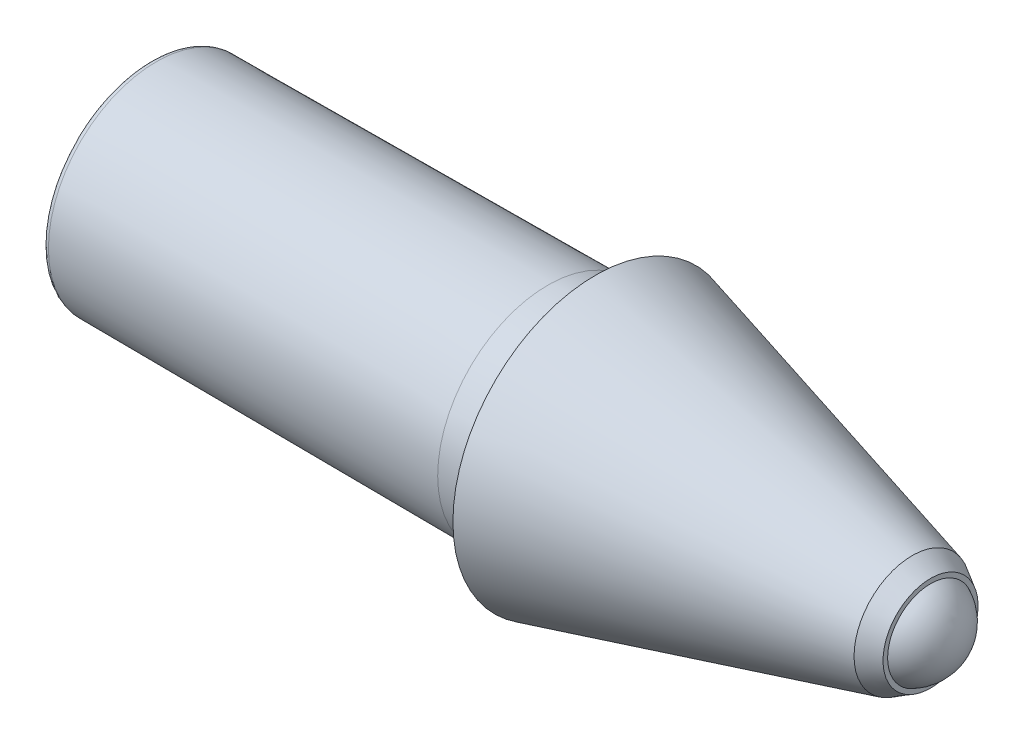
from build123d import *


with BuildPart() as part:
    # Sketch1 → Base-Revolve (revolve)
    with BuildSketch(Plane.XY, mode=Mode.PRIVATE) as base_revolve_sk:
        with BuildLine():
            Line((0, 0.465), (0, 0.860275583))
            ThreePointArc((0, 0.860275583), (0.014547094, 0.895533085), (0.049723658, 0.910274819))
            Line((0.049723658, 0.910274819), (3.35, 0.928515223))
            Line((3.35, 0.928515223), (3.75, 0.93))
            Line((3.75, 0.93), (3.75, 1.15))
            Line((3.75, 1.15), (3.75, 1.2))
            Line((3.75, 1.2), (6.422377484, 0.490183785))
            Line((6.422377484, 0.490183785), (6.577177551, 0.400809924))
            Line((6.577177551, 0.400809924), (6.577177551, 0.36207734))
            ThreePointArc((6.577177551, 0.36207734), (6.49426677, 0.390404237), (6.407177551, 0.4))
            Line((6.407177551, 0.4), (6.241492126, 0.4))
            Line((6.241492126, 0.4), (6.091492126, 0.25))
            Line((6.091492126, 0.25), (5.58660254, 0.25))
            Line((5.58660254, 0.25), (5.5, 0.4))
            Line((5.5, 0.4), (3.028867513, 0.4))
            Line((3.028867513, 0.4), (3, 0.45))
            Line((3, 0.45), (0.636213203, 0.45))
            Line((0.636213203, 0.45), (0.6, 0.465))
            Line((0.6, 0.465), (0, 0.465))
        make_face()
    revolve(base_revolve_sk.sketch.rotate(Axis((-2, 0, 0), (1, 0, 0)), 90), axis=Axis((-2, 0, 0), (1, 0, 0)))


with BuildPart() as body_2:
    # Sketch2 → Esfera (revolve)
    with BuildSketch(Plane.XY):
        with BuildLine():
            Line((6.007177551, 0), (6.807177551, 0))
            ThreePointArc((6.807177551, 0), (6.407177551, 0.4), (6.007177551, 0))
        make_face()
    revolve(axis=Axis((4.979736288, 0, 0), (1, 0, 0)))


solid = Compound([part.part, body_2.part])
